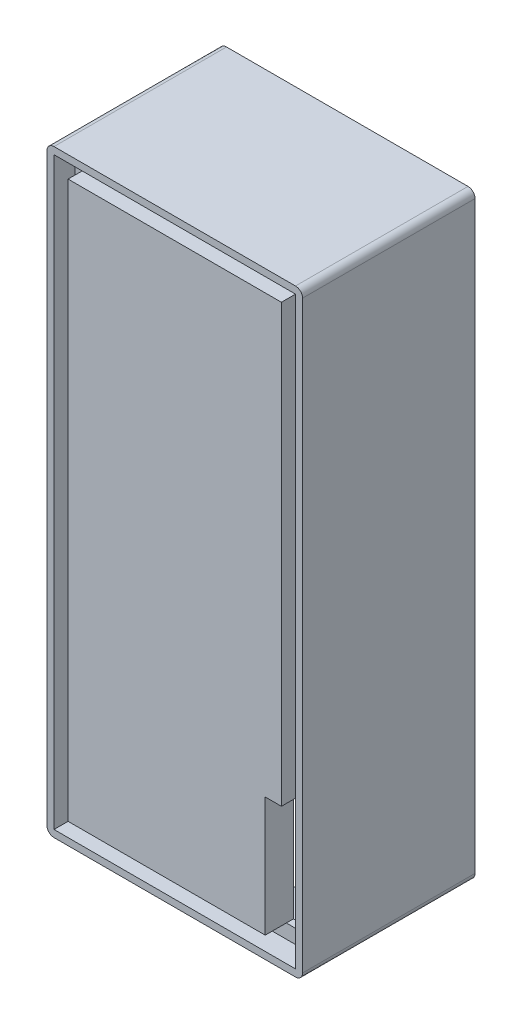
from build123d import *

# Parameters (mm, degrees)
SKIZZE1_W                       = 36.3
SKIZZE1_H                       = 85
AUFSATZ_LINEAR_AUSTRAGEN1_DEPTH = 21.5
WANDUNG1_T                      = -1
SKIZZE4_W                       = 9.03
SKIZZE4_H                       = 3.107106781
SCHNITT_LINEAR_AUSTRAGEN1_DEPTH = 10
SKIZZE8_W                       = 36.3
SKIZZE8_H                       = 85
SKIZZE8_W_2                     = 34.3
SKIZZE8_H_2                     = 83
AUFSATZ_LINEAR_AUSTRAGEN5_DEPTH = 3
VERRUNDUNG1_R                   = 0.9
VERRUNDUNG2_R                   = 1
SKIZZE11_W                      = 34.7
SKIZZE11_H                      = 61.050585676
SCHNITT_LINEAR_AUSTRAGEN5_DEPTH = 20.5
SKIZZE6_W                       = 2.3
SKIZZE6_H                       = 17
SCHNITT_LINEAR_AUSTRAGEN6_DEPTH = 1
AUFSATZ_LINEAR_AUSTRAGEN7_DEPTH = 3
SKIZZE13_R                      = 0.55
SCHNITT_LINEAR_AUSTRAGEN7_DEPTH = 2
SKIZZE14_W                      = 13
SKIZZE14_H                      = 20.1
SCHNITT_LINEAR_AUSTRAGEN8_DEPTH = 3


with BuildPart() as part:
    # Skizze1 → Aufsatz-Linear austragen1 (new body)
    with BuildSketch(Plane.XY):
        with Locations((-18.15, 42.5)):
            Rectangle(SKIZZE1_W, SKIZZE1_H)
    extrude(amount=AUFSATZ_LINEAR_AUSTRAGEN1_DEPTH)

    # Wandung1
    wandung1_openings = [part.faces().sort_by_distance(p)[0] for p in [
        (-18.15, 42.5, 0),
    ]]
    offset(amount=WANDUNG1_T, openings=wandung1_openings, kind=Kind.INTERSECTION)

    # Skizze4 → Schnitt-Linear austragen1 (cut)
    with BuildSketch(Plane(origin=(-35.3, 59.749407146, -1119.925163107), x_dir=(0, -1, 0), z_dir=(1, 0, 0))):
        with Locations((48.249407146, -1137.466609716)):
            Rectangle(SKIZZE4_W, SKIZZE4_H)
    extrude(amount=-SCHNITT_LINEAR_AUSTRAGEN1_DEPTH, mode=Mode.SUBTRACT)

    # Skizze8 → Aufsatz-Linear austragen5 (add)
    with BuildSketch(Plane.XY.offset(21.5)):
        with Locations((-18.15, 42.5)):
            Rectangle(SKIZZE8_W, SKIZZE8_H)
        with Locations((-18.15, 42.5)):
            Rectangle(SKIZZE8_W_2, SKIZZE8_H_2, mode=Mode.SUBTRACT)
    extrude(amount=AUFSATZ_LINEAR_AUSTRAGEN5_DEPTH)

    # Verrundung1
    verrundung1_edges = [part.edges().sort_by_distance(p)[0] for p in [
        (-35.8, 6.985, 15.987893219),
        (-35.8, 6.985, 19.095),
        (-35.8, 16.015, 19.095),
        (-35.8, 16.015, 15.987893219),
    ]]
    fillet(verrundung1_edges, radius=VERRUNDUNG1_R)

    # Verrundung2
    verrundung2_edges = [part.edges().sort_by_distance(p)[0] for p in [
        (-36.3, 85, 12.25),
        (-36.3, 0, 12.25),
        (0, 0, 12.25),
        (0, 85, 12.25),
    ]]
    fillet(verrundung2_edges, radius=VERRUNDUNG2_R)

    # Skizze11 → Schnitt-Linear austragen5 (cut)
    with BuildSketch(Plane(origin=(0, 0, 0), x_dir=(-1, 0, 0), z_dir=(0, 0, -1))):
        with Locations((18.15, 53.474707162)):
            Rectangle(SKIZZE11_W, SKIZZE11_H)
    extrude(amount=-SCHNITT_LINEAR_AUSTRAGEN5_DEPTH, mode=Mode.SUBTRACT)

    # Skizze6 → Schnitt-Linear austragen6 (cut)
    with BuildSketch(Plane(origin=(0, 0, 20.5), x_dir=(-1, 0, 0), z_dir=(0, 0, -1))):
        with Locations((4.15, 11.5)):
            Rectangle(SKIZZE6_W, SKIZZE6_H)
    extrude(amount=-SCHNITT_LINEAR_AUSTRAGEN6_DEPTH, mode=Mode.SUBTRACT)

    # Skizze12 → Aufsatz-Linear austragen7 (add)
    with BuildSketch(Plane.XY.offset(21.5)):
        Polygon((-3, 20), (-5.3, 20), (-5.3, 3), (-33.3, 3), (-33.3, 82), (-3, 82), align=None)
    extrude(amount=AUFSATZ_LINEAR_AUSTRAGEN7_DEPTH)

    # Skizze13 → Schnitt-Linear austragen7 (cut)
    with BuildSketch(Plane(origin=(-2.822587719, 1, -1119.925163107), x_dir=(0, 0, -1), z_dir=(0, 1, 0))):
        with Locations(Location((-1136.220163107, 10.253821552, 0), (0, 0, 180))):
            Circle(SKIZZE13_R)
    extrude(amount=-SCHNITT_LINEAR_AUSTRAGEN7_DEPTH, mode=Mode.SUBTRACT)

    # Skizze14 → Schnitt-Linear austragen8 (cut)
    with BuildSketch(Plane(origin=(-2.822587719, 1, -1119.925163107), x_dir=(0, 0, -1), z_dir=(0, 1, 0))):
        with Locations((-1127.925163107, 15.327412281)):
            Rectangle(SKIZZE14_W, SKIZZE14_H)
    extrude(amount=-SCHNITT_LINEAR_AUSTRAGEN8_DEPTH, mode=Mode.SUBTRACT)


solid = part.part
